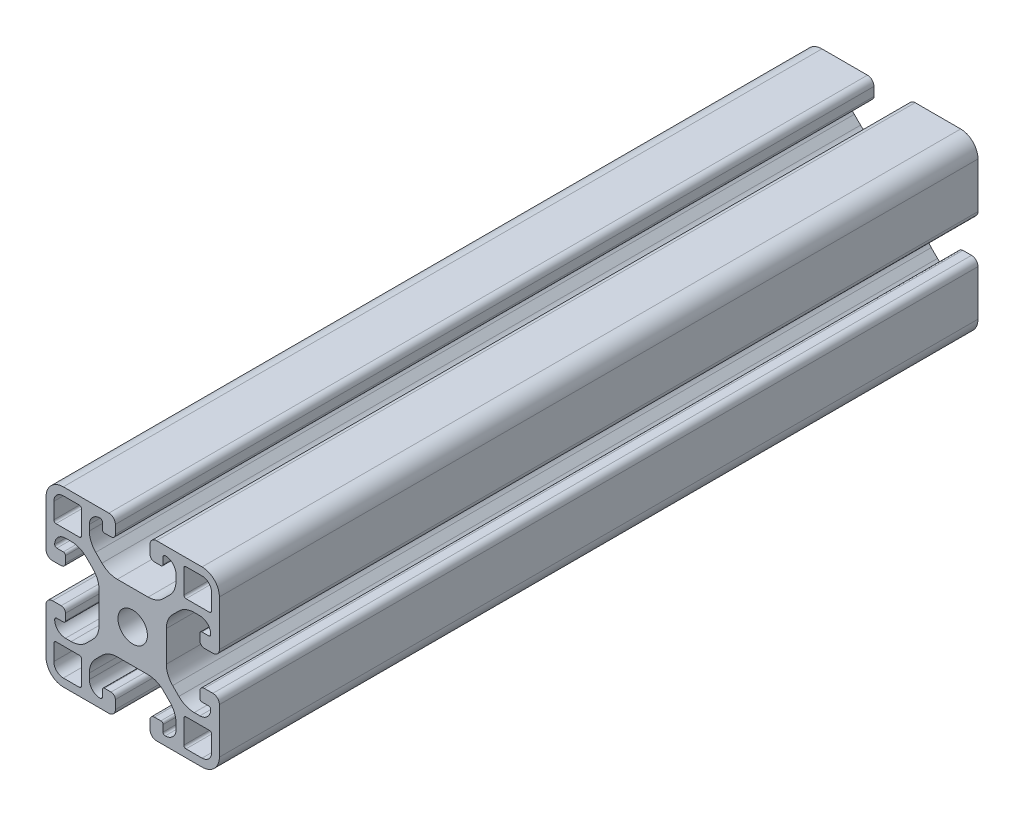
from build123d import *

# Parameters (mm, degrees)
ESQUISSE1_R        = 3.4
BOSS_EXTRU_1_DEPTH = 175


with BuildPart() as part:
    # Esquisse1 → Boss.-Extru.1 (new body)
    with BuildSketch(Plane(origin=(0, 0, -30), x_dir=(-1, 0, 0), z_dir=(0, 0, -1))):
        with BuildLine():
            Line((-4.5, 15), (-4.5, 13.5))
            ThreePointArc((-4.5, 13.5), (-4.353553391, 13.146446609), (-4, 13))
            Line((-4, 13), (-2.5, 13))
            ThreePointArc((-2.5, 13), (-2.146446609, 12.853553391), (-2, 12.5))
            ThreePointArc((-2, 12.5), (-2.732233047, 10.732233047), (-4.5, 10))
            Line((-4.5, 10), (-5.807611845, 10))
            ThreePointArc((-5.807611845, 10), (-7.721029006, 10.380602337), (-9.343145751, 11.464466094))
            Line((-9.343145751, 11.464466094), (-10.785533906, 12.906854249))
            ThreePointArc((-10.785533906, 12.906854249), (-11.869397663, 14.528970994), (-12.25, 16.442388155))
            Line((-12.25, 16.442388155), (-12.25, 23.557611845))
            ThreePointArc((-12.25, 23.557611845), (-11.869397663, 25.471029006), (-10.785533906, 27.093145751))
            Line((-10.785533906, 27.093145751), (-9.343145751, 28.535533906))
            ThreePointArc((-9.343145751, 28.535533906), (-7.721029006, 29.619397663), (-5.807611845, 30))
            Line((-5.807611845, 30), (-4.5, 30))
            ThreePointArc((-4.5, 30), (-2.732233047, 29.267766953), (-2, 27.5))
            ThreePointArc((-2, 27.5), (-2.146446609, 27.146446609), (-2.5, 27))
            Line((-2.5, 27), (-4, 27))
            ThreePointArc((-4, 27), (-4.353553391, 26.853553391), (-4.5, 26.5))
            Line((-4.5, 26.5), (-4.5, 25))
            ThreePointArc((-4.5, 25), (-4.207106781, 24.292893219), (-3.5, 24))
            Line((-3.5, 24), (-1.5, 24))
            ThreePointArc((-1.5, 24), (-0.439339828, 24.439339828), (0, 25.5))
            Line((0, 25.5), (0, 36))
            ThreePointArc((0, 36), (-1.171572875, 38.828427125), (-4, 40))
            Line((-4, 40), (-14.5, 40))
            ThreePointArc((-14.5, 40), (-15.560660172, 39.560660172), (-16, 38.5))
            Line((-16, 38.5), (-16, 36.5))
            ThreePointArc((-16, 36.5), (-15.707106781, 35.792893219), (-15, 35.5))
            Line((-15, 35.5), (-13.5, 35.5))
            ThreePointArc((-13.5, 35.5), (-13.146446609, 35.646446609), (-13, 36))
            Line((-13, 36), (-13, 37.5))
            ThreePointArc((-13, 37.5), (-12.853553391, 37.853553391), (-12.5, 38))
            ThreePointArc((-12.5, 38), (-10.732233047, 37.267766953), (-10, 35.5))
            Line((-10, 35.5), (-10, 34.192388155))
            ThreePointArc((-10, 34.192388155), (-10.380602337, 32.278970994), (-11.464466094, 30.656854249))
            Line((-11.464466094, 30.656854249), (-12.906854249, 29.214466094))
            ThreePointArc((-12.906854249, 29.214466094), (-14.528970994, 28.130602337), (-16.442388155, 27.75))
            Line((-16.442388155, 27.75), (-23.557611845, 27.75))
            ThreePointArc((-23.557611845, 27.75), (-25.471029006, 28.130602337), (-27.093145751, 29.214466094))
            Line((-27.093145751, 29.214466094), (-28.535533906, 30.656854249))
            ThreePointArc((-28.535533906, 30.656854249), (-29.619397663, 32.278970994), (-30, 34.192388155))
            Line((-30, 34.192388155), (-30, 35.5))
            ThreePointArc((-30, 35.5), (-29.267766953, 37.267766953), (-27.5, 38))
            ThreePointArc((-27.5, 38), (-27.146446609, 37.853553391), (-27, 37.5))
            Line((-27, 37.5), (-27, 36))
            ThreePointArc((-27, 36), (-26.853553391, 35.646446609), (-26.5, 35.5))
            Line((-26.5, 35.5), (-25, 35.5))
            ThreePointArc((-25, 35.5), (-24.292893219, 35.792893219), (-24, 36.5))
            Line((-24, 36.5), (-24, 38.5))
            ThreePointArc((-24, 38.5), (-24.439339828, 39.560660172), (-25.5, 40))
            Line((-25.5, 40), (-36, 40))
            ThreePointArc((-36, 40), (-38.828427125, 38.828427125), (-40, 36))
            Line((-40, 36), (-40, 25.5))
            ThreePointArc((-40, 25.5), (-39.560660172, 24.439339828), (-38.5, 24))
            Line((-38.5, 24), (-36.5, 24))
            ThreePointArc((-36.5, 24), (-35.792893219, 24.292893219), (-35.5, 25))
            Line((-35.5, 25), (-35.5, 26.5))
            ThreePointArc((-35.5, 26.5), (-35.646446609, 26.853553391), (-36, 27))
            Line((-36, 27), (-37.5, 27))
            ThreePointArc((-37.5, 27), (-37.853553391, 27.146446609), (-38, 27.5))
            ThreePointArc((-38, 27.5), (-37.267766953, 29.267766953), (-35.5, 30))
            Line((-35.5, 30), (-34.192388155, 30))
            ThreePointArc((-34.192388155, 30), (-32.278970994, 29.619397663), (-30.656854249, 28.535533906))
            Line((-30.656854249, 28.535533906), (-29.214466094, 27.093145751))
            ThreePointArc((-29.214466094, 27.093145751), (-28.130602337, 25.471029006), (-27.75, 23.557611845))
            Line((-27.75, 23.557611845), (-27.75, 16.442388155))
            ThreePointArc((-27.75, 16.442388155), (-28.130602337, 14.528970994), (-29.214466094, 12.906854249))
            Line((-29.214466094, 12.906854249), (-30.656854249, 11.464466094))
            ThreePointArc((-30.656854249, 11.464466094), (-32.278970994, 10.380602337), (-34.192388155, 10))
            Line((-34.192388155, 10), (-35.5, 10))
            ThreePointArc((-35.5, 10), (-37.267766953, 10.732233047), (-38, 12.5))
            ThreePointArc((-38, 12.5), (-37.853553391, 12.853553391), (-37.5, 13))
            Line((-37.5, 13), (-36, 13))
            ThreePointArc((-36, 13), (-35.646446609, 13.146446609), (-35.5, 13.5))
            Line((-35.5, 13.5), (-35.5, 15))
            ThreePointArc((-35.5, 15), (-35.792893219, 15.707106781), (-36.5, 16))
            Line((-36.5, 16), (-38.5, 16))
            ThreePointArc((-38.5, 16), (-39.560660172, 15.560660172), (-40, 14.5))
            Line((-40, 14.5), (-40, 4))
            ThreePointArc((-40, 4), (-38.828427125, 1.171572875), (-36, 0))
            Line((-36, 0), (-25.5, 0))
            ThreePointArc((-25.5, 0), (-24.439339828, 0.439339828), (-24, 1.5))
            Line((-24, 1.5), (-24, 3.5))
            ThreePointArc((-24, 3.5), (-24.292893219, 4.207106781), (-25, 4.5))
            Line((-25, 4.5), (-26.5, 4.5))
            ThreePointArc((-26.5, 4.5), (-26.853553391, 4.353553391), (-27, 4))
            Line((-27, 4), (-27, 2.5))
            ThreePointArc((-27, 2.5), (-27.146446609, 2.146446609), (-27.5, 2))
            ThreePointArc((-27.5, 2), (-29.267766953, 2.732233047), (-30, 4.5))
            Line((-30, 4.5), (-30, 5.807611845))
            ThreePointArc((-30, 5.807611845), (-29.619397663, 7.721029006), (-28.535533906, 9.343145751))
            Line((-28.535533906, 9.343145751), (-27.093145751, 10.785533906))
            ThreePointArc((-27.093145751, 10.785533906), (-25.471029006, 11.869397663), (-23.557611845, 12.25))
            Line((-23.557611845, 12.25), (-16.442388155, 12.25))
            ThreePointArc((-16.442388155, 12.25), (-14.528970994, 11.869397663), (-12.906854249, 10.785533906))
            Line((-12.906854249, 10.785533906), (-11.464466094, 9.343145751))
            ThreePointArc((-11.464466094, 9.343145751), (-10.380602337, 7.721029006), (-10, 5.807611845))
            Line((-10, 5.807611845), (-10, 4.5))
            ThreePointArc((-10, 4.5), (-10.732233047, 2.732233047), (-12.5, 2))
            ThreePointArc((-12.5, 2), (-12.853553391, 2.146446609), (-13, 2.5))
            Line((-13, 2.5), (-13, 4))
            ThreePointArc((-13, 4), (-13.146446609, 4.353553391), (-13.5, 4.5))
            Line((-13.5, 4.5), (-15, 4.5))
            ThreePointArc((-15, 4.5), (-15.707106781, 4.207106781), (-16, 3.5))
            Line((-16, 3.5), (-16, 1.5))
            ThreePointArc((-16, 1.5), (-15.560660172, 0.439339828), (-14.5, 0))
            Line((-14.5, 0), (-4, 0))
            ThreePointArc((-4, 0), (-1.171572875, 1.171572875), (0, 4))
            Line((0, 4), (0, 14.5))
            ThreePointArc((0, 14.5), (-0.439339828, 15.560660172), (-1.5, 16))
            Line((-1.5, 16), (-3.5, 16))
            ThreePointArc((-3.5, 16), (-4.207106781, 15.707106781), (-4.5, 15))
        make_face()
        with Locations(Location((-20, 20, 0), (0, 0, 180))):
            Circle(ESQUISSE1_R, mode=Mode.SUBTRACT)
        with BuildLine():
            Line((-4, 1.8), (-7.7, 1.8))
            ThreePointArc((-7.7, 1.8), (-8.053553391, 1.946446609), (-8.2, 2.3))
            Line((-8.2, 2.3), (-8.2, 7.7))
            ThreePointArc((-8.2, 7.7), (-8.053553391, 8.053553391), (-7.7, 8.2))
            Line((-7.7, 8.2), (-2.3, 8.2))
            ThreePointArc((-2.3, 8.2), (-1.946446609, 8.053553391), (-1.8, 7.7))
            Line((-1.8, 7.7), (-1.8, 4))
            ThreePointArc((-1.8, 4), (-2.444365081, 2.444365081), (-4, 1.8))
        make_face(mode=Mode.SUBTRACT)
        with BuildLine():
            Line((-38.2, 4), (-38.2, 7.7))
            ThreePointArc((-38.2, 7.7), (-38.053553391, 8.053553391), (-37.7, 8.2))
            Line((-37.7, 8.2), (-32.3, 8.2))
            ThreePointArc((-32.3, 8.2), (-31.946446609, 8.053553391), (-31.8, 7.7))
            Line((-31.8, 7.7), (-31.8, 2.3))
            ThreePointArc((-31.8, 2.3), (-31.946446609, 1.946446609), (-32.3, 1.8))
            Line((-32.3, 1.8), (-36, 1.8))
            ThreePointArc((-36, 1.8), (-37.555634919, 2.444365081), (-38.2, 4))
        make_face(mode=Mode.SUBTRACT)
        with BuildLine():
            Line((-36, 38.2), (-32.3, 38.2))
            ThreePointArc((-32.3, 38.2), (-31.946446609, 38.053553391), (-31.8, 37.7))
            Line((-31.8, 37.7), (-31.8, 32.3))
            ThreePointArc((-31.8, 32.3), (-31.946446609, 31.946446609), (-32.3, 31.8))
            Line((-32.3, 31.8), (-37.7, 31.8))
            ThreePointArc((-37.7, 31.8), (-38.053553391, 31.946446609), (-38.2, 32.3))
            Line((-38.2, 32.3), (-38.2, 36))
            ThreePointArc((-38.2, 36), (-37.555634919, 37.555634919), (-36, 38.2))
        make_face(mode=Mode.SUBTRACT)
        with BuildLine():
            Line((-1.8, 36), (-1.8, 32.3))
            ThreePointArc((-1.8, 32.3), (-1.946446609, 31.946446609), (-2.3, 31.8))
            Line((-2.3, 31.8), (-7.7, 31.8))
            ThreePointArc((-7.7, 31.8), (-8.053553391, 31.946446609), (-8.2, 32.3))
            Line((-8.2, 32.3), (-8.2, 37.7))
            ThreePointArc((-8.2, 37.7), (-8.053553391, 38.053553391), (-7.7, 38.2))
            Line((-7.7, 38.2), (-4, 38.2))
            ThreePointArc((-4, 38.2), (-2.444365081, 37.555634919), (-1.8, 36))
        make_face(mode=Mode.SUBTRACT)
    extrude(amount=-BOSS_EXTRU_1_DEPTH)


solid = part.part
